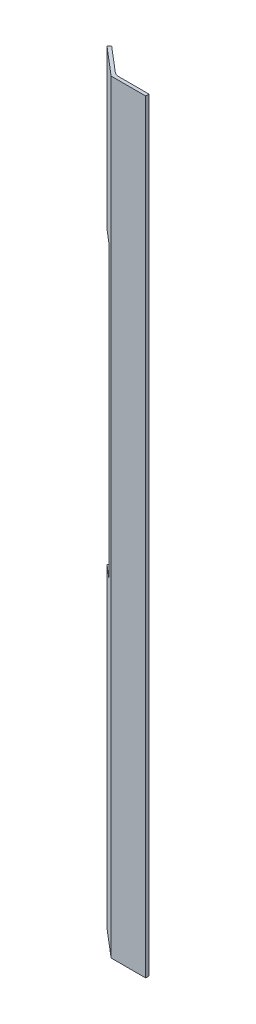
from build123d import *

# Parameters (mm, degrees)
EXTRUDE_START       = 40
EXTRUDE_1_DEPTH     = 460
SKETCH_2_W          = 14.817451962
SKETCH_2_H          = 174.961932368
CUT_EXTRUDE_1_DEPTH = 501.666670065


with BuildPart() as part:
    # Эскиз1 → Вытянуть1 (new body)
    with BuildSketch(Plane(origin=(0, 0, 0), x_dir=(1, 0, 0), z_dir=(0, 1, 0)).offset(EXTRUDE_START)):
        with BuildLine():
            Line((-20.508447565, 12.792651291), (-19.211965496, 14.315521688))
            Line((-19.211965496, 14.315521688), (-4.37520086, 1.680230584))
            ThreePointArc((-4.37520086, 1.680230584), (-2.860623355, 0.794693725), (-1.133379225, 0.48688167))
            Line((-1.133379225, 0.48688167), (17.122829042, 0.48688167))
            Line((17.122829042, 0.48688167), (17.122829042, -1.51311833))
            Line((17.122829042, -1.51311833), (-3.70464164, -1.51311833))
            Line((-3.70464164, -1.51311833), (-20.508447565, 12.792651291))
        make_face()
    extrude(amount=EXTRUDE_1_DEPTH)

    # Эскиз2 → Вырез-Вытянуть1 (cut, through all)
    with BuildSketch(Plane(origin=(-2.30361675, 0, 2.705868318), x_dir=(0.7614351985155554, 0, 0.6482410342315402), z_dir=(-0.6482410342315401, 0, 0.7614351985155553))):
        with Locations((-21.841147888, 317.116726633)):
            Rectangle(SKETCH_2_W, SKETCH_2_H)
    extrude(amount=-CUT_EXTRUDE_1_DEPTH, mode=Mode.SUBTRACT)


solid = part.part
